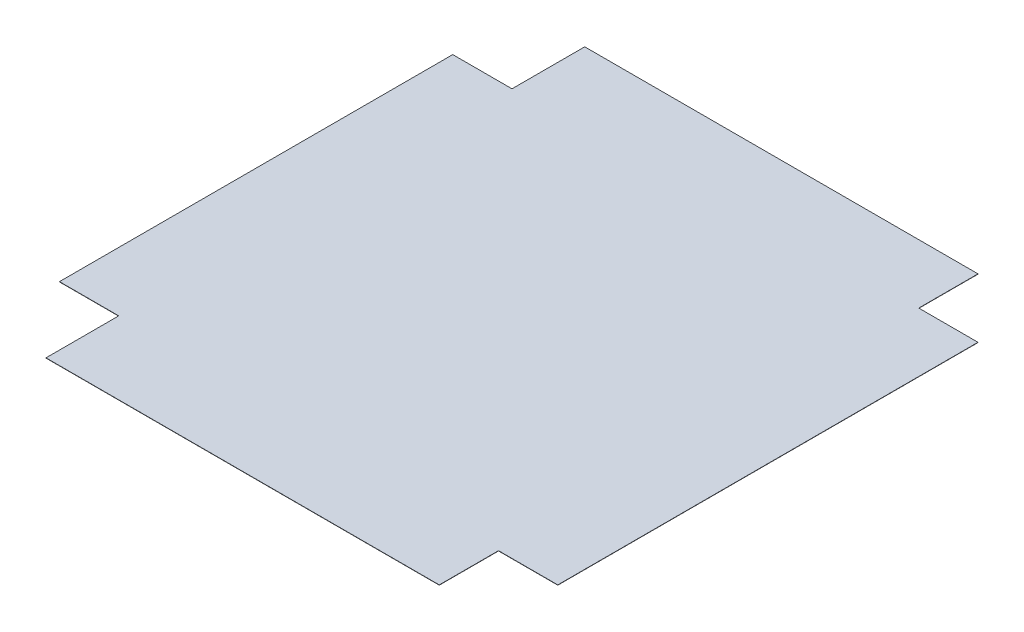
from build123d import *

# Parameters (mm, degrees)
BOSS_EXTRUDE1_DEPTH = 0.05


with BuildPart() as part:
    # Sketch1 → Boss-Extrude1 (new, symmetric)
    with BuildSketch(Plane(origin=(0, 0, 0), x_dir=(1, 0, 0), z_dir=(0, 1, 0))):
        Polygon((-73, 100), (73, 100), (73, 78), (95, 78), (95, -78), (73, -78), (73, -100), (-73, -100), (-73, -73), (-95, -73), (-95, 73), (-73, 73), align=None)
    extrude(amount=BOSS_EXTRUDE1_DEPTH, both=True)


solid = part.part
